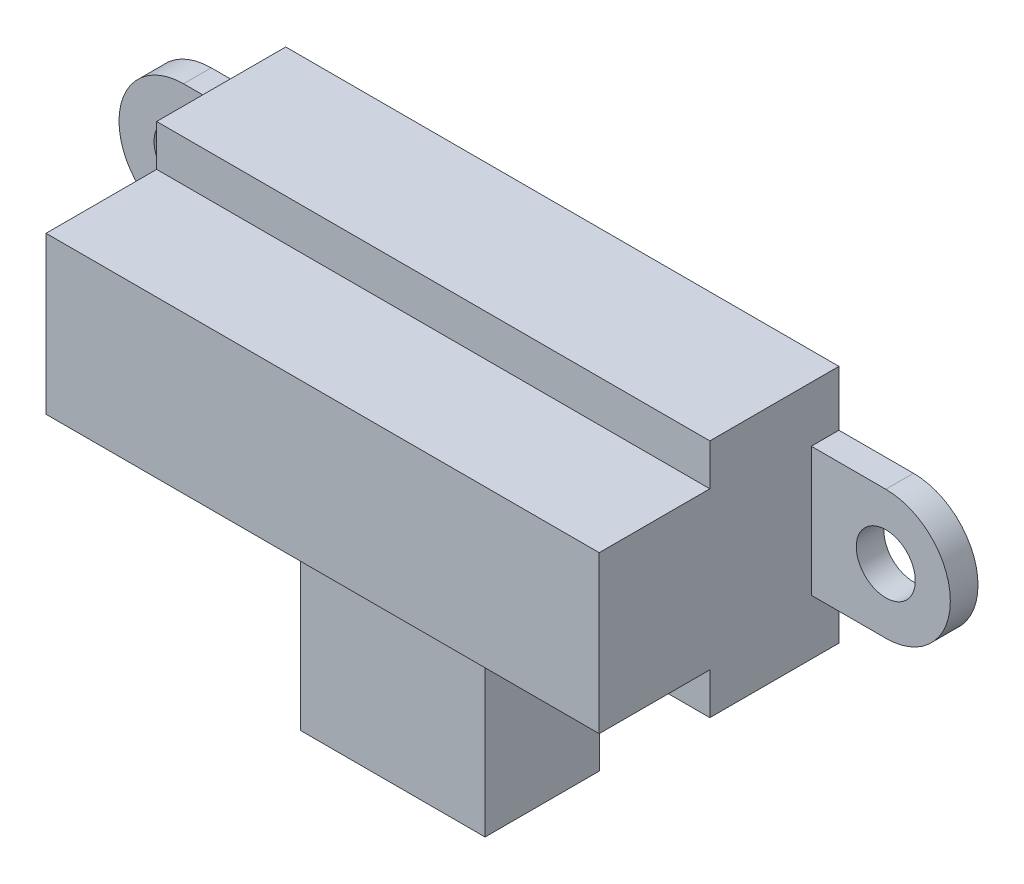
from build123d import *

# Parameters (mm, degrees)
BOSS_EXTRUDE1_DEPTH      = 7
SKETCH1_3_R              = 1.6
BOSS_EXTRUDE2_DEPTH      = 1.5
SKETCH2_W                = 30
SKETCH2_H                = 8.5
BOSS_EXTRUDE3_DEPTH      = 6
BOSS_EXTRUDE4_DEPTH      = 10
BOSS_EXTRUDE4_DEPTH_BACK = 6
SKETCH3_W                = 10
SKETCH3_H                = 6.2


with BuildPart() as part:
    # Sketch1 → Boss-Extrude1 (new body)
    with BuildSketch(Plane.XY):
        Polygon((0, 0), (15, 0), (15, 13), (0, 13), (0, 10), (0, 3), align=None)
    boss_extrude1 = extrude(amount=BOSS_EXTRUDE1_DEPTH)

    # Sketch1<3> → Boss-Extrude2 (add)
    with BuildSketch(Plane.XY):
        with BuildLine():
            Line((0, 3), (0, 10))
            Line((0, 10), (-4.041019256, 10))
            ThreePointArc((-4.041019256, 10), (-7.541019256, 6.5), (-4.041019256, 3))
            Line((-4.041019256, 3), (0, 3))
        make_face()
        with Locations((-4.041019256, 6.5)):
            Circle(SKETCH1_3_R, mode=Mode.SUBTRACT)
    boss_extrude2 = extrude(amount=BOSS_EXTRUDE2_DEPTH)

    # Mirror1: Boss-Extrude1, Boss-Extrude2 across plane
    add(boss_extrude1.mirror(Plane(origin=(15, -13.88108581, 7), x_dir=(0, 0, 1), z_dir=(-1, 0, 0))))
    add(boss_extrude2.mirror(Plane(origin=(15, -13.88108581, 7), x_dir=(0, 0, 1), z_dir=(-1, 0, 0))))

    # Sketch2 → Boss-Extrude3 (add)
    with BuildSketch(Plane.XY.offset(7)):
        with Locations((15, 6.5)):
            Rectangle(SKETCH2_W, SKETCH2_H)
    extrude(amount=BOSS_EXTRUDE3_DEPTH)

    # Sketch3 → Boss-Extrude4 (add, two sides: drawn at the far end of the back side and taken through both)
    with BuildSketch(Plane.XZ.offset(-BOSS_EXTRUDE4_DEPTH_BACK)):
        with Locations((14.510328708, 5.6)):
            Rectangle(SKETCH3_W, SKETCH3_H)
    extrude(amount=BOSS_EXTRUDE4_DEPTH + BOSS_EXTRUDE4_DEPTH_BACK)


solid = part.part
